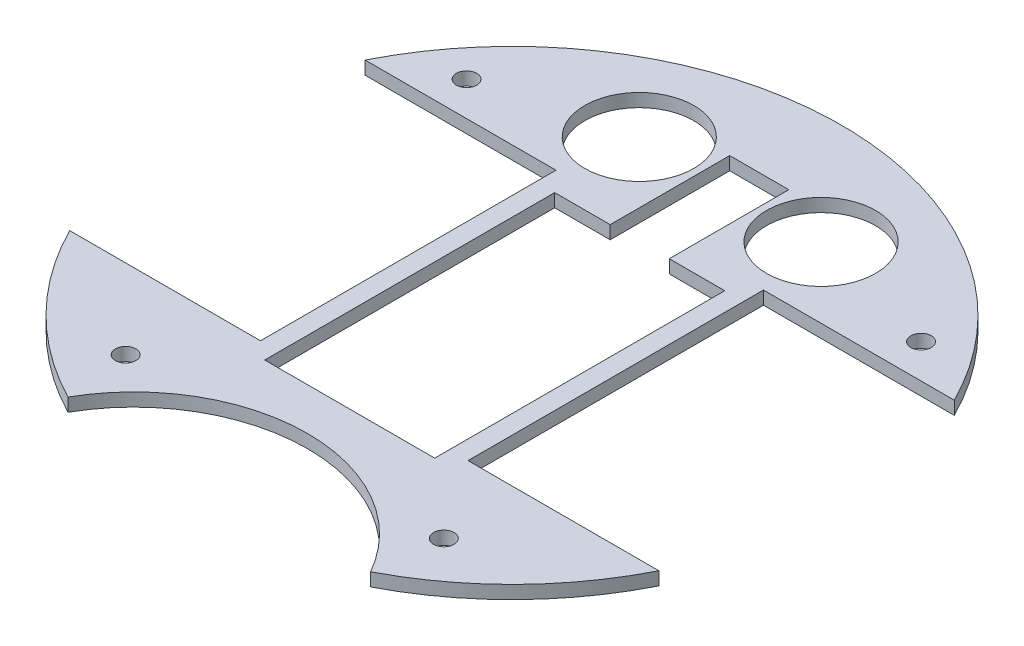
from build123d import *

# Parameters (mm, degrees)
BOSS_EXTRUDE1_DEPTH  = 2.9
SOLENOID_PLACEMENT_W = 37.4
SOLENOID_PLACEMENT_H = 63.8
CUT_EXTRUDE1_DEPTH   = 103.571487266
CUT_EXTRUDE3_DEPTH   = 103.571487266
SKETCH4_W            = 13
SKETCH4_H            = 26.3
CUT_EXTRUDE4_DEPTH   = 98.286484159
SKETCH5_R            = 12
CUT_EXTRUDE5_DEPTH   = 98.286484159
SKETCH6_R            = 2.25
CUT_EXTRUDE6_DEPTH   = 98.286484159


with BuildPart() as part:
    # Sketch1 → Boss-Extrude1 (new body)
    with BuildSketch(Plane(origin=(0, 0, 0), x_dir=(1, 0, 0), z_dir=(0, 1, 0))):
        with BuildLine():
            ThreePointArc((33.29110537, -64.404598464), (0, 72.5), (-33.29110537, -64.404598464))
            ThreePointArc((-33.29110537, -64.404598464), (0, -44.989799638), (33.29110537, -64.404598464))
        make_face()
    extrude(amount=BOSS_EXTRUDE1_DEPTH)

    # solenoid placement → Cut-Extrude1 (cut, through all)
    with BuildSketch(Plane(origin=(0, 2.9, 0), x_dir=(1, 0, 0), z_dir=(0, 1, 0))):
        with Locations((0, -3.8)):
            Rectangle(SOLENOID_PLACEMENT_W, SOLENOID_PLACEMENT_H)
    extrude(amount=-CUT_EXTRUDE1_DEPTH, mode=Mode.SUBTRACT)

    # Sketch3 → Cut-Extrude3 (cut, through all)
    with BuildSketch(Plane(origin=(0, 2.9, 0), x_dir=(1, 0, 0), z_dir=(0, 1, 0))):
        with BuildLine():
            Line((-34.63, -32.5), (-22.83, -32.5))
            Line((-22.83, -32.5), (-22.83, 32.5))
            Line((-22.83, 32.5), (-64.807406984, 32.5))
            ThreePointArc((-64.807406984, 32.5), (-72.5, 0), (-64.807406984, -32.5))
            Line((-64.807406984, -32.5), (-34.63, -32.5))
        make_face()
        with BuildLine():
            Line((34.63, -32.5), (64.807406984, -32.5))
            ThreePointArc((64.807406984, -32.5), (72.5, 0), (64.807406984, 32.5))
            Line((64.807406984, 32.5), (22.83, 32.5))
            Line((22.83, 32.5), (22.83, -32.5))
            Line((22.83, -32.5), (34.63, -32.5))
        make_face()
    extrude(amount=-CUT_EXTRUDE3_DEPTH, mode=Mode.SUBTRACT)

    # Sketch4 → Cut-Extrude4 (cut, through all)
    with BuildSketch(Plane(origin=(0, 2.9, 0), x_dir=(1, 0, 0), z_dir=(0, 1, 0))):
        with Locations((0, 41.25)):
            Rectangle(SKETCH4_W, SKETCH4_H)
    extrude(amount=-CUT_EXTRUDE4_DEPTH, mode=Mode.SUBTRACT)

    # Sketch5 → Cut-Extrude5 (cut, through all)
    with BuildSketch(Plane(origin=(0, 2.9, 0), x_dir=(1, 0, 0), z_dir=(0, 1, 0))):
        with Locations(Location((-20, 48, 0), (0, 0, 270))):
            Circle(SKETCH5_R)
        with Locations(Location((20, 48, 0), (0, 0, 270))):
            Circle(SKETCH5_R)
    extrude(amount=-CUT_EXTRUDE5_DEPTH, mode=Mode.SUBTRACT)

    # Sketch6 → Cut-Extrude6 (cut, through all)
    with BuildSketch(Plane(origin=(0, 2.9, 0), x_dir=(1, 0, 0), z_dir=(0, 1, 0))):
        with Locations(Location((35, -50, 0), (0, 0, 270))):
            Circle(SKETCH6_R)
        with Locations(Location((-35, -50, 0), (0, 0, 270))):
            Circle(SKETCH6_R)
        with Locations(Location((-50, 40, 0), (0, 0, 270))):
            Circle(SKETCH6_R)
        with Locations(Location((50, 40, 0), (0, 0, 270))):
            Circle(SKETCH6_R)
    extrude(amount=-CUT_EXTRUDE6_DEPTH, mode=Mode.SUBTRACT)


solid = part.part
